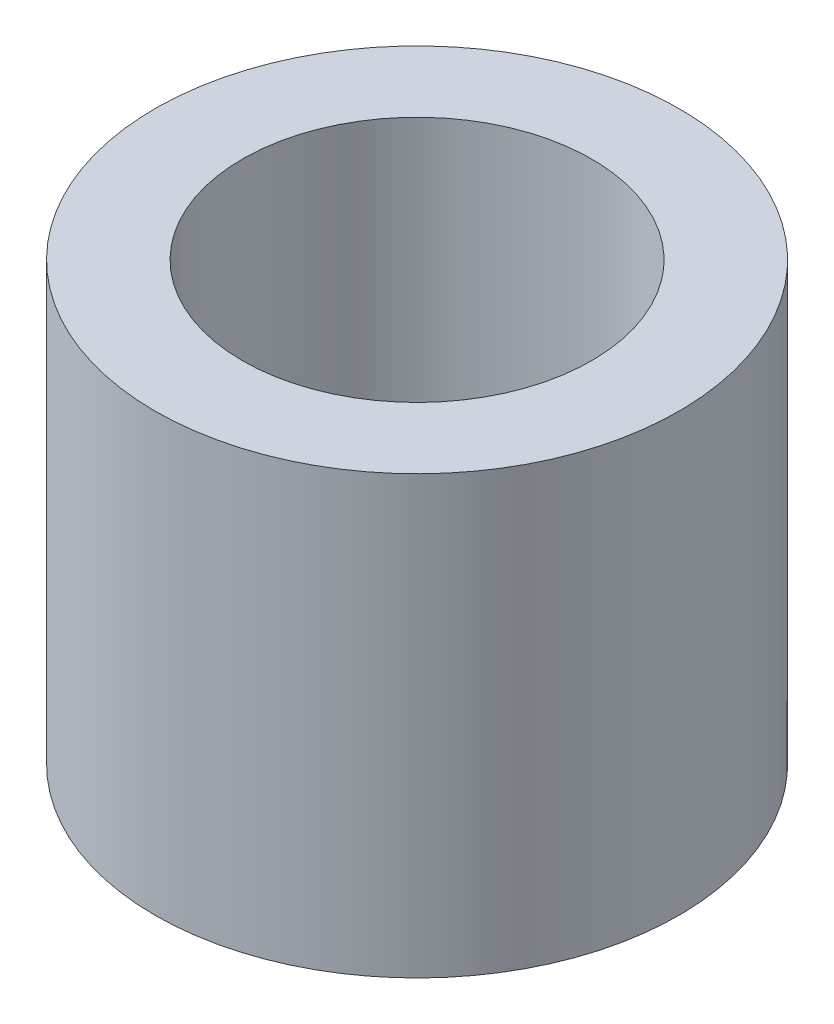
from build123d import *

# Parameters (mm, degrees)
SKETCH1_R           = 7.62
SKETCH1_R_2         = 5.08
BOSS_EXTRUDE1_DEPTH = 12.7


with BuildPart() as part:
    # Sketch1 → Boss-Extrude1 (new body)
    with BuildSketch(Plane(origin=(0, 0, 0), x_dir=(1, 0, 0), z_dir=(0, 1, 0))):
        with Locations(Location((0, 0, 0), (0, 0, 270))):
            Circle(SKETCH1_R)
        with Locations(Location((0, 0, 0), (0, 0, 270))):
            Circle(SKETCH1_R_2, mode=Mode.SUBTRACT)
    extrude(amount=BOSS_EXTRUDE1_DEPTH)


solid = part.part
